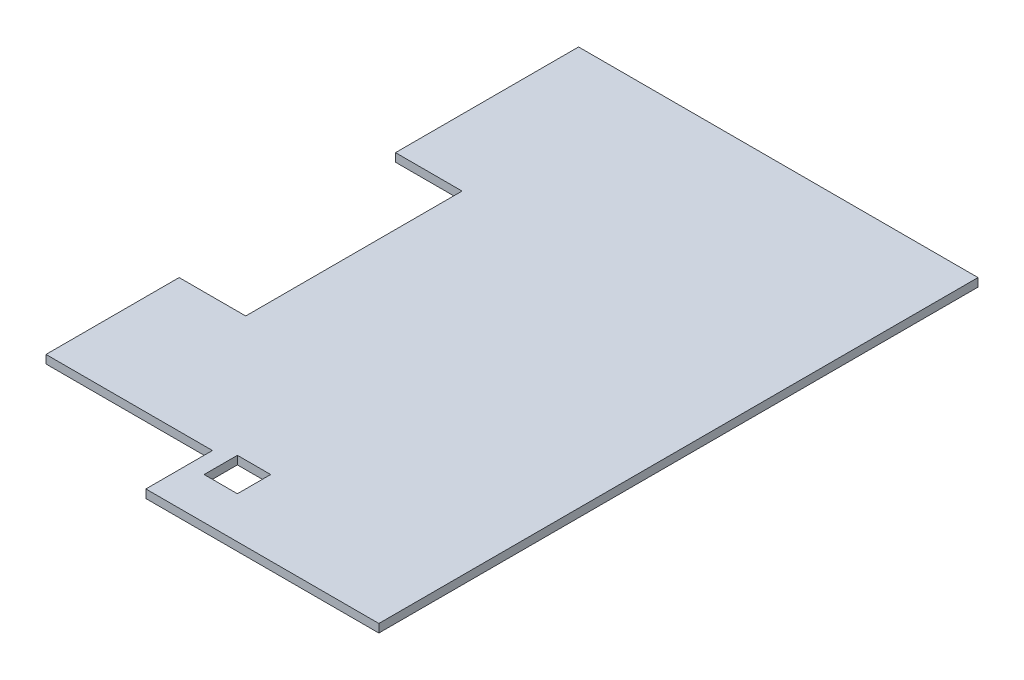
from build123d import *

# Parameters (mm, degrees)
BOSS_EXTRUDE1_DEPTH = 12.7
SKETCH3_W           = 50.8
SKETCH3_H           = 50.8
CUT_EXTRUDE1_DEPTH  = 12.7


with BuildPart() as part:
    # Sketch2 → Boss-Extrude1 (new body)
    with BuildSketch(Plane(origin=(0, 0, 0), x_dir=(1, 0, 0), z_dir=(0, 1, 0))):
        Polygon((0, 0), (254, 0), (254, -101.6), (609.6, -101.6), (609.6, 812.8), (0, 812.8), (0, 533.4), (101.6, 533.4), (101.6, 203.2), (0, 203.2), align=None)
    extrude(amount=BOSS_EXTRUDE1_DEPTH)

    # Sketch3 → Cut-Extrude1 (cut)
    with BuildSketch(Plane(origin=(0, 12.7, 0), x_dir=(1, 0, 0), z_dir=(0, 1, 0))):
        with Locations((304.8, -12.7)):
            Rectangle(SKETCH3_W, SKETCH3_H)
    extrude(amount=-CUT_EXTRUDE1_DEPTH, mode=Mode.SUBTRACT)


solid = part.part
